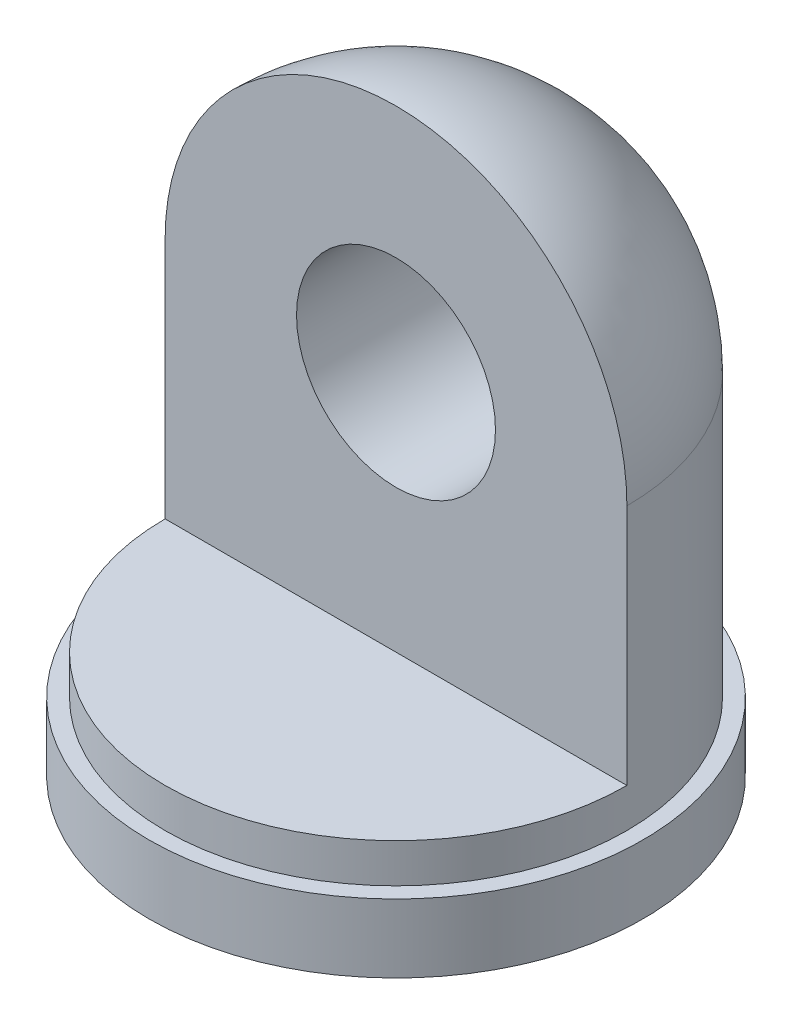
from build123d import *
from build123d.topology import SkipClean

# Parameters (mm, degrees)
REVOLVE1_ANGLE = 180
SKETCH2_R      = 6
EXTRUDE1_DEPTH = 1.016
SKETCH3_R      = 6.419039945
EXTRUDE2_DEPTH = 1.778
SKETCH4_R      = 2.584873193
EXTRUDE3_DEPTH = 16.281774039


with BuildPart() as part:
    # Sketch1 → Revolve1 (revolve)
    with BuildSketch(Plane.XY):
        with BuildLine():
            Line((-6, 0), (-6, 6.293269303))
            ThreePointArc((-6, 6.293269303), (-4.242640687, 10.535909991), (0, 12.293269303))
            Line((0, 12.293269303), (0, 0))
            Line((0, 0), (-6, 0))
        make_face()
    revolve(axis=Axis((0, 12.293269303, 0), (0, -1, 0)), revolution_arc=REVOLVE1_ANGLE)

    # Sketch2 → Extrude1 (add)
    with BuildSketch(Plane.XZ):
        Circle(SKETCH2_R)
    extrude(amount=EXTRUDE1_DEPTH)

    # Sketch3 → Extrude2 (add)
    with BuildSketch(Plane.XZ.offset(1.016)):
        with Locations(Location((0, 0, 0), (0, 0, 270))):
            Circle(SKETCH3_R)
    extrude(amount=EXTRUDE2_DEPTH)

    # Sketch4 → Extrude3 (cut, through all)
    with SkipClean():  # the faces are left unmerged after this step: merging them gives an invalid solid
        with BuildSketch(Plane.XY):
            with Locations((0, 6.293269303)):
                Circle(SKETCH4_R)
        extrude(amount=-EXTRUDE3_DEPTH, mode=Mode.SUBTRACT)


solid = part.part
